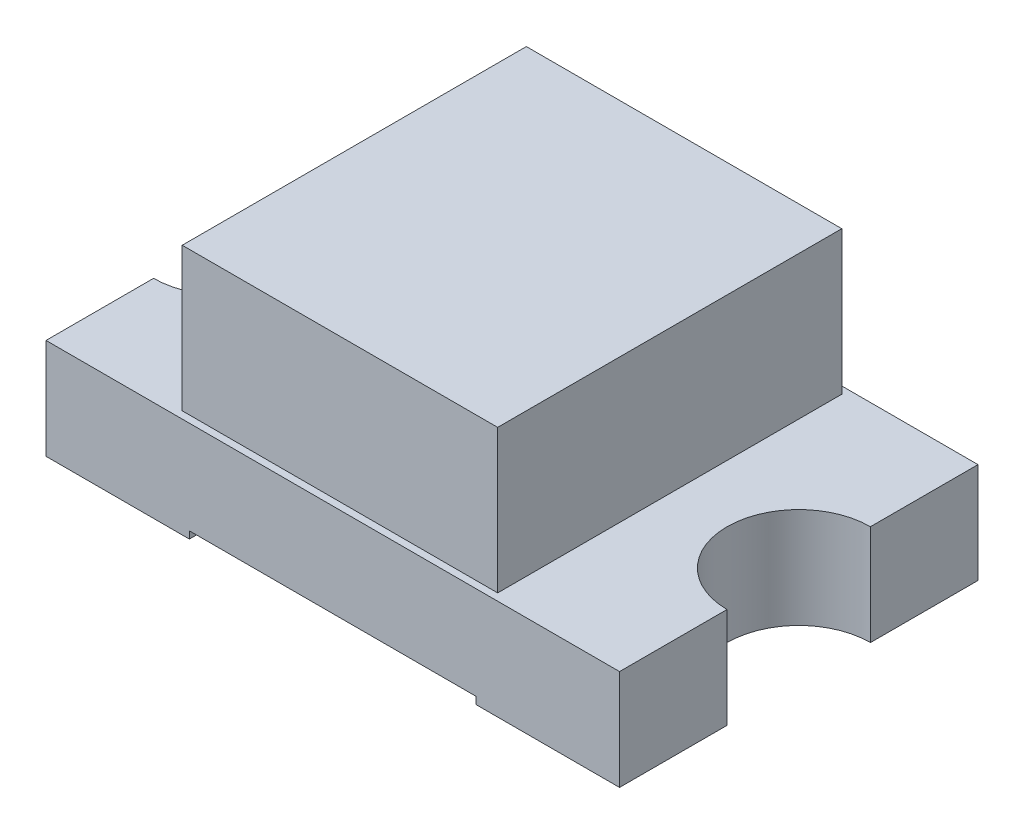
from build123d import *

# Parameters (mm, degrees)
BOSS_EXTRUDE1_DEPTH = 0.3302
BOSS_EXTRUDE2_START = 0.0254
SKETCH2_W           = 0.4318
SKETCH2_H           = 0.4318
BOSS_EXTRUDE2_DEPTH = 0.0254
SKETCH3_W           = 1.1176
SKETCH3_H           = 1.2192
BOSS_EXTRUDE4_DEPTH = 0.508
SKETCH4_W           = 0.3302
SKETCH4_H           = 0.3302
BOSS_EXTRUDE3_DEPTH = 0.3302


with BuildPart() as part:
    # Sketch1 → Boss-Extrude1 (new body)
    with BuildSketch(Plane(origin=(0, 0, 0), x_dir=(1, 0, 0), z_dir=(0, 1, 0))):
        with BuildLine():
            Line((0, 1.27), (-2.032, 1.27))
            Line((-2.032, 1.27), (-2.032, 0.889))
            ThreePointArc((-2.032, 0.889), (-1.852394878, 0.814605122), (-1.778, 0.635))
            ThreePointArc((-1.778, 0.635), (-1.852394878, 0.455394878), (-2.032, 0.381))
            Line((-2.032, 0.381), (-2.032, 0))
            Line((-2.032, 0), (0, 0))
            Line((0, 0), (0, 0.381))
            ThreePointArc((0, 0.381), (-0.254, 0.635), (0, 0.889))
            Line((0, 0.889), (0, 1.27))
        make_face()
    extrude(amount=BOSS_EXTRUDE1_DEPTH)

    # Sketch2 → Boss-Extrude2 (add)
    with BuildSketch(Plane.XZ.offset(BOSS_EXTRUDE2_START)):
        with BuildLine():
            Line((-2.032, -1.27), (-1.524, -1.27))
            Line((-1.524, -1.27), (-1.524, 0))
            Line((-1.524, 0), (-2.032, 0))
            Line((-2.032, 0), (-2.032, -0.381))
            ThreePointArc((-2.032, -0.381), (-1.778, -0.635), (-2.032, -0.889))
            Line((-2.032, -0.889), (-2.032, -1.27))
        make_face()
        with Locations((-0.7239, -0.635)):
            Rectangle(SKETCH2_W, SKETCH2_H)
        with BuildLine():
            Line((-0.508, -0.8509), (-0.508, -1.27))
            Line((-0.508, -1.27), (0, -1.27))
            Line((0, -1.27), (0, -0.889))
            ThreePointArc((0, -0.889), (-0.254, -0.635), (0, -0.381))
            Line((0, -0.381), (0, 0))
            Line((0, 0), (-0.508, 0))
            Line((-0.508, 0), (-0.508, -0.4191))
            Line((-0.508, -0.4191), (-0.508, -0.8509))
        make_face()
    extrude(amount=-BOSS_EXTRUDE2_DEPTH)

    # Sketch3 → Boss-Extrude4 (add)
    with BuildSketch(Plane(origin=(0, 0.3302, 0), x_dir=(1, 0, 0), z_dir=(0, 1, 0))):
        with Locations((-1.016, 0.635)):
            Rectangle(SKETCH3_W, SKETCH3_H)
    extrude(amount=BOSS_EXTRUDE4_DEPTH)

    # Sketch4 → Boss-Extrude3 (add)
    with BuildSketch(Plane(origin=(0, 0.3302, 0), x_dir=(1, 0, 0), z_dir=(0, 1, 0))):
        with Locations((-0.8001, 0.635)):
            Rectangle(SKETCH4_W, SKETCH4_H)
    extrude(amount=BOSS_EXTRUDE3_DEPTH)


solid = part.part
